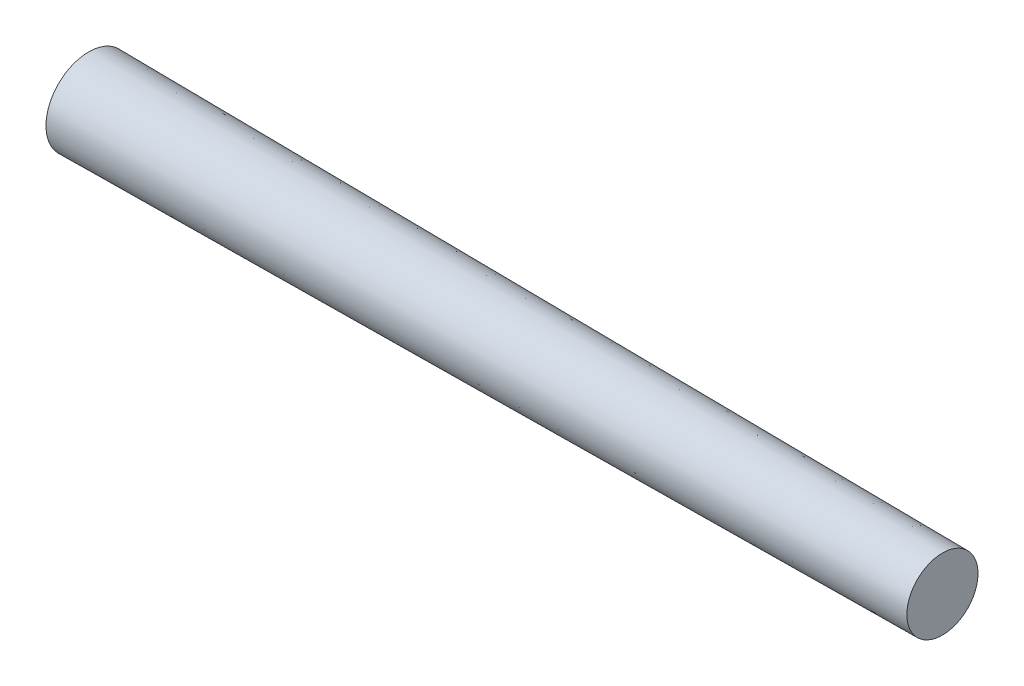
from build123d import *


with BuildPart() as part:
    # Sketch1 → Revolve1 (revolve)
    with BuildSketch(Plane.XY):
        Polygon((-16.285714286, 0), (-16.285714286, 3), (43.714285714, 2.5), (43.714285714, 0), align=None)
    revolve(axis=Axis((43.714285714, 0, 0), (-1, 0, 0)))


solid = part.part
